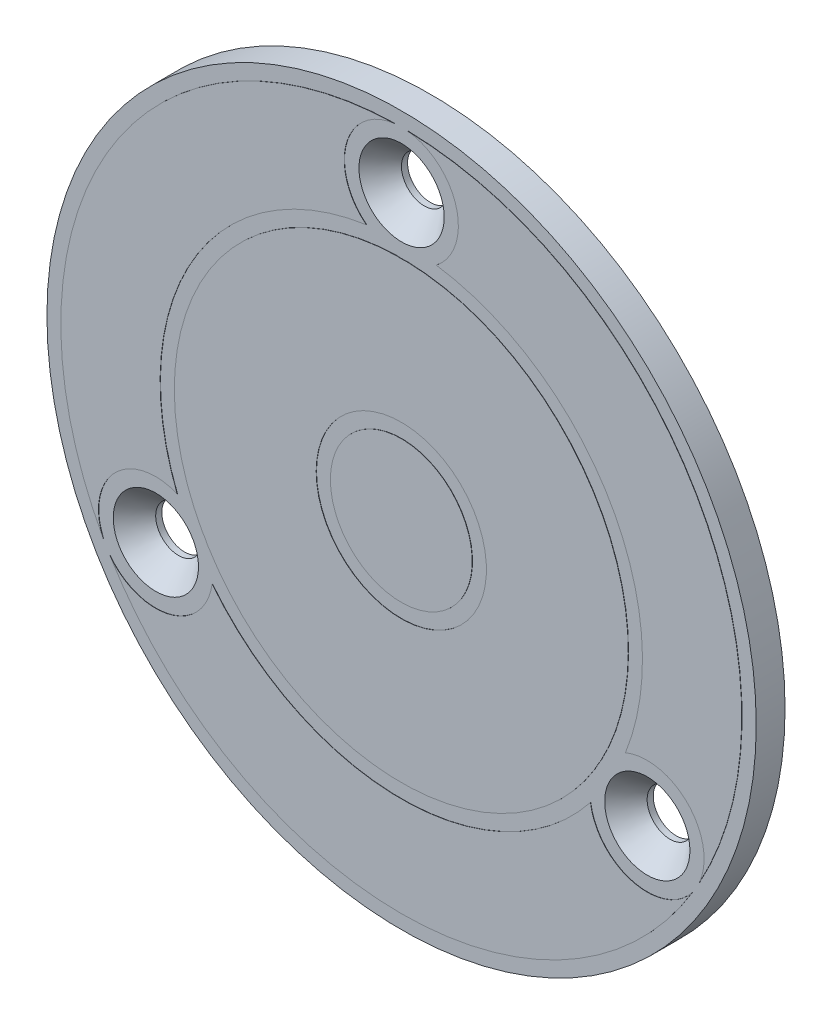
from build123d import *

# Parameters (mm, degrees)
SKETCH1_R         = 12.5
EXTRUDE1_DEPTH    = 1.016
SKETCH2_R         = 12
SKETCH2_R_2       = 8.5
SKETCH2_R_3       = 8
SKETCH2_R_4       = 3
SKETCH2_R_5       = 2.5
EXTRUDE2_DEPTH    = 0.01
CIRPATTERN1_COUNT = 3
SKETCH6_R         = 2.0113
EXTRUDE5_DEPTH    = 0.01


with BuildPart() as part:
    # Sketch1 → Extrude1 (new body)
    with BuildSketch(Plane.XY):
        Circle(SKETCH1_R)
    extrude(amount=EXTRUDE1_DEPTH)

    # Sketch2 → Extrude2 (add)
    # profile 1 of 3: a face of its own
    with BuildSketch(Plane.XY.offset(1.016)):
        with Locations(Location((0, 0, 0), (0, 0, 180))):
            Circle(SKETCH2_R)
        with Locations(Location((0, 0, 0), (0, 0, 180))):
            Circle(SKETCH2_R_2, mode=Mode.SUBTRACT)
    # profile 2 of 3: a face of its own
    with BuildSketch(Plane.XY.offset(1.016)):
        with Locations(Location((0, 0, 0), (0, 0, 180))):
            Circle(SKETCH2_R_3)
        with Locations(Location((0, 0, 0), (0, 0, 180))):
            Circle(SKETCH2_R_4, mode=Mode.SUBTRACT)
    # profile 3 of 3: a face of its own
    with BuildSketch(Plane.XY.offset(1.016)):
        with Locations(Location((0, 0, 0), (0, 0, 180))):
            Circle(SKETCH2_R_5)
    extrude(amount=EXTRUDE2_DEPTH)

    # Sketch4 → CSK for #0 Flat Head Machine Screw1 (revolve, cut)
    with BuildSketch(Plane(origin=(0, 10, 1.026), x_dir=(0, -1, 0), z_dir=(1, 0, 0))):
        Polygon((0, 0), (0, 1.026), (0.80645, 1.026), (0.80645, 0.810837172), (1.5113, 0), align=None)
    csk_for_0_flat_head_machine_screw1 = revolve(axis=Axis((0, 10, 7.376), (0, 0, -1)), mode=Mode.SUBTRACT)

    # CirPattern1: CSK for #0 Flat Head Machine Screw1 ×3 about axis
    cirpattern1_axis = Axis((0, 0, 0), (0, 0, 1))
    for i in range(1, CIRPATTERN1_COUNT):
        add(csk_for_0_flat_head_machine_screw1.rotate(cirpattern1_axis, i * 360 / CIRPATTERN1_COUNT), mode=Mode.SUBTRACT)

    # Sketch6 → Extrude5 (cut)
    with BuildSketch(Plane.XY.offset(1.026)):
        with Locations((0, 10)):
            Circle(SKETCH6_R)
        with Locations((-8.660254038, -5)):
            Circle(SKETCH6_R)
        with Locations((8.660254038, -5)):
            Circle(SKETCH6_R)
    extrude(amount=-EXTRUDE5_DEPTH, mode=Mode.SUBTRACT)


solid = part.part
